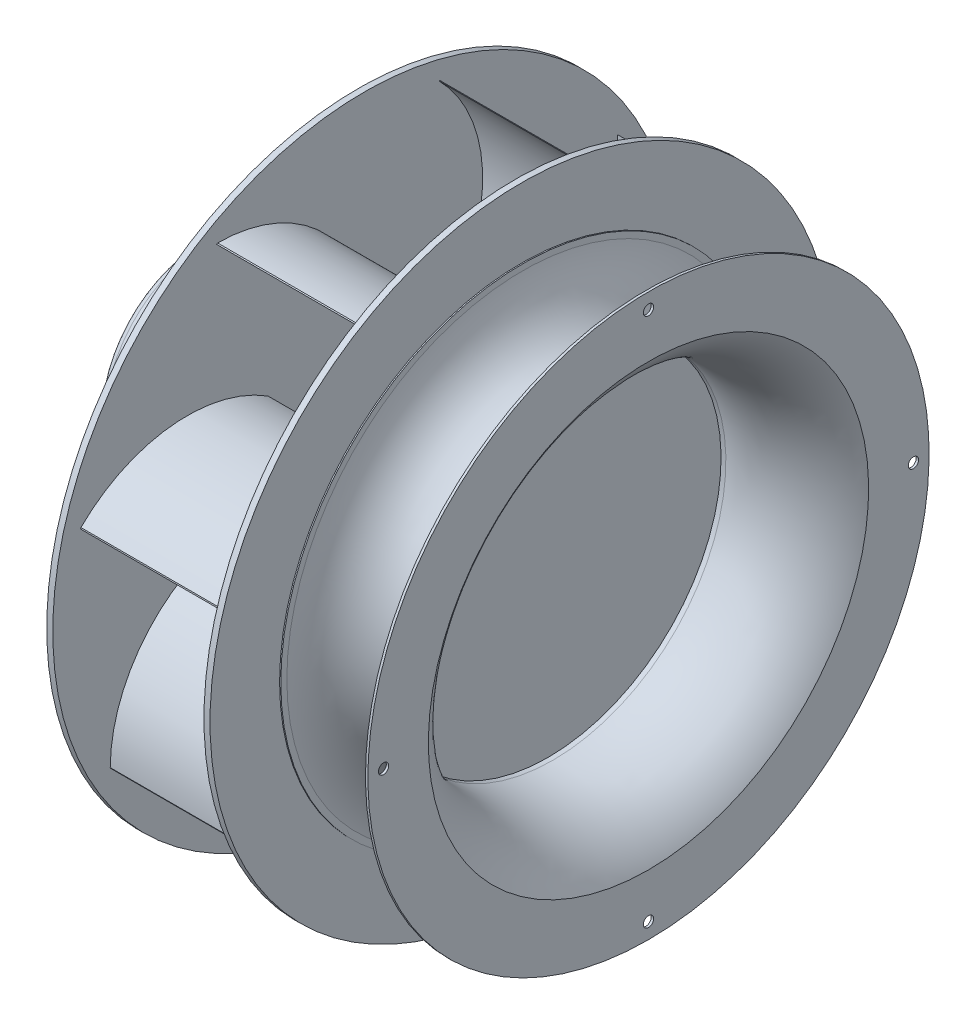
from build123d import *

# Parameters (mm, degrees)
SKETCH2_R         = 257.5
EXTRUDE1_DEPTH    = 5
SKETCH9_R         = 252.5
SKETCH9_R_2       = 100
EXTRUDE7_DEPTH    = 3
SKETCH3_R         = 257.5
EXTRUDE2_DEPTH    = 5
EXTRUDE3_DEPTH    = 130
CIRPATTERN1_COUNT = 8
SKETCH7_R         = 4.25
EXTRUDE5_DEPTH    = 5
CIRPATTERN2_COUNT = 4
SKETCH8_R         = 5
EXTRUDE6_DEPTH    = 90
CIRPATTERN3_COUNT = 8


with BuildPart() as part:
    # Sketch1 → Revolve1 (revolve)
    with BuildSketch(Plane.XY, mode=Mode.PRIVATE) as revolve1_sk:
        with BuildLine():
            Line((0, 0), (0, 79.5))
            ThreePointArc((0, 79.5), (1.464466094, 83.035533906), (5, 84.5))
            Line((5, 84.5), (70, 84.5))
            Line((70, 84.5), (70, 108.5))
            Line((70, 108.5), (90, 108.5))
            Line((90, 108.5), (90, 68.5))
            Line((90, 68.5), (95, 68.5))
            Line((95, 68.5), (95, 103.5))
            Line((95, 103.5), (105, 103.5))
            Line((105, 103.5), (105, 68.5))
            Line((105, 68.5), (130, 68.5))
            Line((130, 68.5), (130, 0))
            Line((130, 0), (0, 0))
        make_face()
    revolve(revolve1_sk.sketch.rotate(Axis((0, 0, 0), (1, 0, 0)), 90), axis=Axis((0, 0, 0), (1, 0, 0)))

    # Sketch2 → Extrude1 (add)
    with BuildSketch(Plane(origin=(130, 0, 0), x_dir=(0, 0, -1), z_dir=(1, 0, 0))):
        Circle(SKETCH2_R)
    extrude(amount=EXTRUDE1_DEPTH)

    # Sketch9 → Extrude7 (cut)
    with BuildSketch(Plane.ZY.offset(-130)):
        Circle(SKETCH9_R)
        Circle(SKETCH9_R_2, mode=Mode.SUBTRACT)
    extrude(amount=-EXTRUDE7_DEPTH, mode=Mode.SUBTRACT)



with BuildPart() as body_2:
    # Sketch3 → Extrude2 (new body)
    with BuildSketch(Plane(origin=(260, 0, 0), x_dir=(0, 0, -1), z_dir=(1, 0, 0))):
        Circle(SKETCH3_R)
    extrude(amount=EXTRUDE2_DEPTH)


with BuildPart() as part_1:
    add(part.part)

    add(body_2.part)  # Extrude3 merges body 2
    # Sketch4 → Extrude3 (add)
    with BuildSketch(Plane(origin=(135, 0, 0), x_dir=(0, 0, -1), z_dir=(1, 0, 0))):
        with BuildLine():
            Line((-121.25, 210.011160418), (-122.116025404, 209.511160418))
            ThreePointArc((-122.116025404, 209.511160418), (-44.469436379, 181.921031018), (-0.866025404, 112))
            Line((-0.866025404, 112), (0, 112.5))
            ThreePointArc((0, 112.5), (-43.603410976, 182.421031018), (-121.25, 210.011160418))
        make_face()
    extrude3 = extrude(amount=EXTRUDE3_DEPTH)

    # CirPattern1: Extrude3 ×8 about axis
    cirpattern1_axis = Axis((0, 0, 0), (1, 0, 0))
    for i in range(1, CIRPATTERN1_COUNT):
        add(extrude3.rotate(cirpattern1_axis, i * 360 / CIRPATTERN1_COUNT))

    # Sketch5 → Revolve2 (revolve)
    with BuildSketch(Plane.XY, mode=Mode.PRIVATE) as revolve2_sk:
        with BuildLine():
            Line((265, 200), (266, 200))
            Line((266, 200), (266, 195))
            ThreePointArc((266, 195), (280.264553623, 164.150526649), (309, 146))
            Line((309, 146), (309, 145))
            ThreePointArc((309, 145), (279.425239697, 163.334210933), (265, 195))
            Line((265, 195), (265, 200))
        make_face()
    revolve(revolve2_sk.sketch.rotate(Axis((0, 0, 0), (1, 0, 0)), 90), axis=Axis((0, 0, 0), (1, 0, 0)))

    # Sketch8 → Extrude6 (cut)
    with BuildSketch(Plane(origin=(0, 0, 0), x_dir=(0, 0, -1), z_dir=(1, 0, 0))):
        with Locations(Location((0, 95, 0), (0, 0, 180))):
            Circle(SKETCH8_R)
    extrude6 = extrude(amount=EXTRUDE6_DEPTH, mode=Mode.SUBTRACT)

    # CirPattern3: Extrude6 ×8 about axis
    cirpattern3_axis = Axis((0, 0, 0), (1, 0, 0))
    for i in range(1, CIRPATTERN3_COUNT):
        add(extrude6.rotate(cirpattern3_axis, i * 360 / CIRPATTERN3_COUNT), mode=Mode.SUBTRACT)


with BuildPart() as body_2_2:
    # Sketch6 → Revolve3 (revolve)
    with BuildSketch(Plane.XY, mode=Mode.PRIVATE) as revolve3_sk:
        with BuildLine():
            Line((370, 232), (368, 232))
            Line((368, 232), (368, 182))
            ThreePointArc((368, 182), (334.85220133, 152.361635071), (291, 145))
            Line((291, 145), (287, 145))
            Line((287, 145), (287, 143))
            Line((287, 143), (291, 143))
            ThreePointArc((291, 143), (336.352293074, 150.645355054), (370, 182))
            Line((370, 182), (370, 232))
        make_face()
    revolve(revolve3_sk.sketch.rotate(Axis((0, 0, 0), (1, 0, 0)), 180), axis=Axis((0, 0, 0), (1, 0, 0)))

    # Sketch7 → Extrude5 (cut)
    with BuildSketch(Plane(origin=(370, 0, 0), x_dir=(0, 0, -1), z_dir=(1, 0, 0))):
        with Locations((0, 219)):
            Circle(SKETCH7_R)
    extrude5 = extrude(amount=-EXTRUDE5_DEPTH, mode=Mode.SUBTRACT)

    # CirPattern2: Extrude5 ×4 about axis
    cirpattern2_axis = Axis((0, 0, 0), (1, 0, 0))
    for i in range(1, CIRPATTERN2_COUNT):
        add(extrude5.rotate(cirpattern2_axis, i * 360 / CIRPATTERN2_COUNT), mode=Mode.SUBTRACT)


solid = Compound([part_1.part, body_2_2.part])
